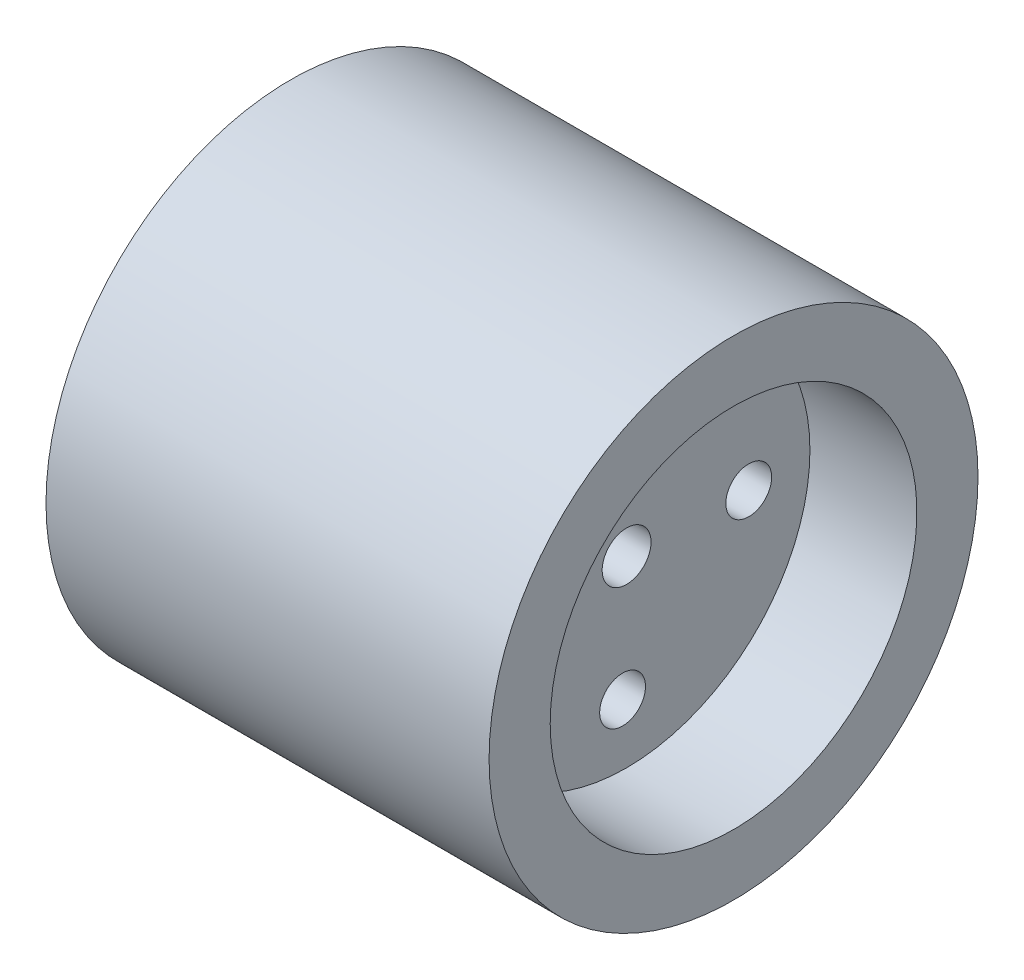
from build123d import *

# Parameters (mm, degrees)
SKETCH4_R               = 1.5
CUT_EXTRUDE1_DEPTH      = 17
SKETCH5_R               = 12
SKETCH5_R_2             = 1.5
SKETCH5_R_3             = 1.6
BOSS_EXTRUDE1_DEPTH     = 2
CUT_EXTRUDE2_DEPTH      = 31.066592757
CUT_EXTRUDE2_DEPTH_BACK = 31.066592757
SKETCH6_W               = 2
SKETCH6_H               = 36


with BuildPart() as part:
    # Sketch3 → Revolve1 (revolve)
    with BuildSketch(Plane.XY, mode=Mode.PRIVATE) as revolve1_sk:
        Polygon((-7, 1.6), (6, 1.6), (6, 12), (15, 12), (15, 16), (-14, 16), (-14, 18), (-16, 18), (-16, 13), (-7, 13), align=None)
    revolve(revolve1_sk.sketch.rotate(Axis((0, 0, 0), (1, 0, 0)), 90), axis=Axis((0, 0, 0), (1, 0, 0)))

    # Sketch4 → Cut-Extrude1 (cut)
    with BuildSketch(Plane.ZY.offset(7)):
        with Locations((0.262567942, -7.995689969)):
            Circle(SKETCH4_R)
        with Locations((-7.995689969, -0.262567942)):
            Circle(SKETCH4_R)
        with Locations((-0.262567942, 7.995689969)):
            Circle(SKETCH4_R)
        with Locations((7.995689969, 0.262567942)):
            Circle(SKETCH4_R)
    extrude(amount=-CUT_EXTRUDE1_DEPTH, mode=Mode.SUBTRACT)

    # Sketch5 → Boss-Extrude1 (add)
    with BuildSketch(Plane(origin=(6, 0, 0), x_dir=(0, 0, -1), z_dir=(1, 0, 0))):
        with Locations(Location((0, 0, 0), (0, 0, 180))):
            Circle(SKETCH5_R)
        with Locations(Location((7.995689969, -0.262567942, 0), (0, 0, 180))):
            Circle(SKETCH5_R_2, mode=Mode.SUBTRACT)
        with Locations(Location((-0.262567942, -7.995689969, 0), (0, 0, 180))):
            Circle(SKETCH5_R_2, mode=Mode.SUBTRACT)
        with Locations(Location((-7.995689969, 0.262567942, 0), (0, 0, 180))):
            Circle(SKETCH5_R_2, mode=Mode.SUBTRACT)
        with Locations(Location((0.262567942, 7.995689969, 0), (0, 0, 180))):
            Circle(SKETCH5_R_2, mode=Mode.SUBTRACT)
        with Locations(Location((0, 0, 0), (0, 0, 180))):
            Circle(SKETCH5_R_3, mode=Mode.SUBTRACT)
    extrude(amount=BOSS_EXTRUDE1_DEPTH)

    # Sketch6 → Cut-Extrude2 (cut, two sides: drawn at the far end of the back side and taken through both)
    with BuildSketch(Plane.XY.offset(-CUT_EXTRUDE2_DEPTH_BACK)):
        with Locations((-15, 0)):
            Rectangle(SKETCH6_W, SKETCH6_H)
    extrude(amount=CUT_EXTRUDE2_DEPTH + CUT_EXTRUDE2_DEPTH_BACK, mode=Mode.SUBTRACT)


solid = part.part
